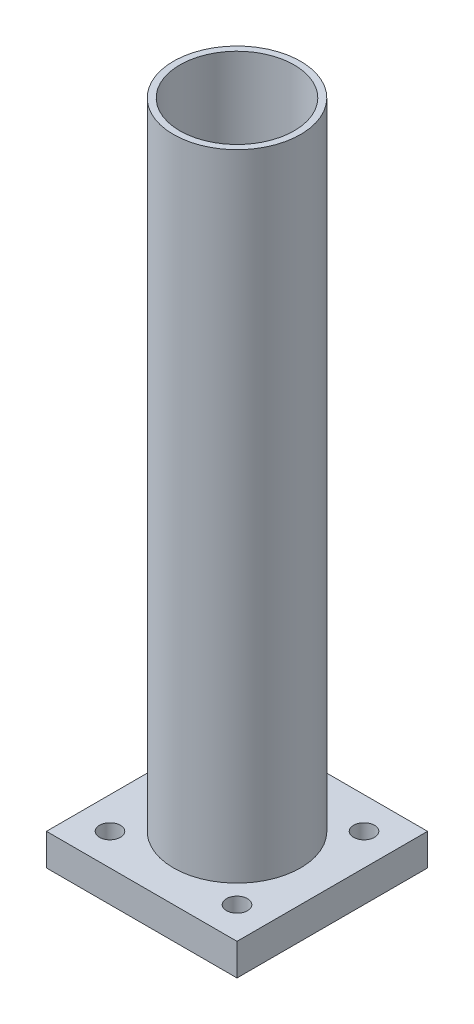
from build123d import *

# Parameters (mm, degrees)
SKETCH1_R                     = 20
SKETCH1_R_2                   = 18
BOSS_EXTRUDE1_DEPTH           = 200
SKETCH2_W                     = 60
SKETCH2_H                     = 60
BOSS_EXTRUDE2_DEPTH           = 10
SKETCH5_W                     = 3.3
SKETCH5_H                     = 10
M6_CLEARANCE_HOLE1_AT_2_COUNT = 2
M6_CLEARANCE_HOLE1_AT_2_PITCH = 40
M6_CLEARANCE_HOLE1_AT_3_COUNT = 2
M6_CLEARANCE_HOLE1_AT_3_PITCH = 56.568542495
M6_CLEARANCE_HOLE1_AT_4_COUNT = 2
M6_CLEARANCE_HOLE1_AT_4_PITCH = 40


with BuildPart() as part:
    # Sketch1 → Boss-Extrude1 (new body)
    with BuildSketch(Plane(origin=(0, 0, 0), x_dir=(1, 0, 0), z_dir=(0, 1, 0))):
        with Locations(Location((0, 0, 0), (0, 0, 270))):
            Circle(SKETCH1_R)
        with Locations(Location((0, 0, 0), (0, 0, 270))):
            Circle(SKETCH1_R_2, mode=Mode.SUBTRACT)
    extrude(amount=BOSS_EXTRUDE1_DEPTH)


with BuildPart() as body_2:
    # Sketch2 → Boss-Extrude2 (new body)
    with BuildSketch(Plane(origin=(0, 0, 0), x_dir=(1, 0, 0), z_dir=(0, 1, 0))):
        Rectangle(SKETCH2_W, SKETCH2_H)
    extrude(amount=-BOSS_EXTRUDE2_DEPTH)

    # Sketch5 → M6 Clearance Hole1 (revolve, cut)
    with BuildSketch(Plane(origin=(20, 0, -20), x_dir=(0, 0, 1), z_dir=(1, 0, 0))):
        with Locations((1.65, 5)):
            Rectangle(SKETCH5_W, SKETCH5_H)
    m6_clearance_hole1 = revolve(axis=Axis((20, 6.35, -20), (0, -1, 0)), mode=Mode.SUBTRACT)

    # M6 Clearance Hole1 at 2: M6 Clearance Hole1 ×2
    with Locations(*[(-i * M6_CLEARANCE_HOLE1_AT_2_PITCH, 0, 0) for i in range(1, M6_CLEARANCE_HOLE1_AT_2_COUNT)]):
        add(m6_clearance_hole1, mode=Mode.SUBTRACT)

    # M6 Clearance Hole1 at 3: M6 Clearance Hole1 ×2
    with Locations(*[Vector(-0.7071067811865476, 0, 0.7071067811865476) * (i * M6_CLEARANCE_HOLE1_AT_3_PITCH) for i in range(1, M6_CLEARANCE_HOLE1_AT_3_COUNT)]):
        add(m6_clearance_hole1, mode=Mode.SUBTRACT)

    # M6 Clearance Hole1 at 4: M6 Clearance Hole1 ×2
    with Locations(*[(0, 0, i * M6_CLEARANCE_HOLE1_AT_4_PITCH) for i in range(1, M6_CLEARANCE_HOLE1_AT_4_COUNT)]):
        add(m6_clearance_hole1, mode=Mode.SUBTRACT)


solid = Compound([part.part, body_2.part])
